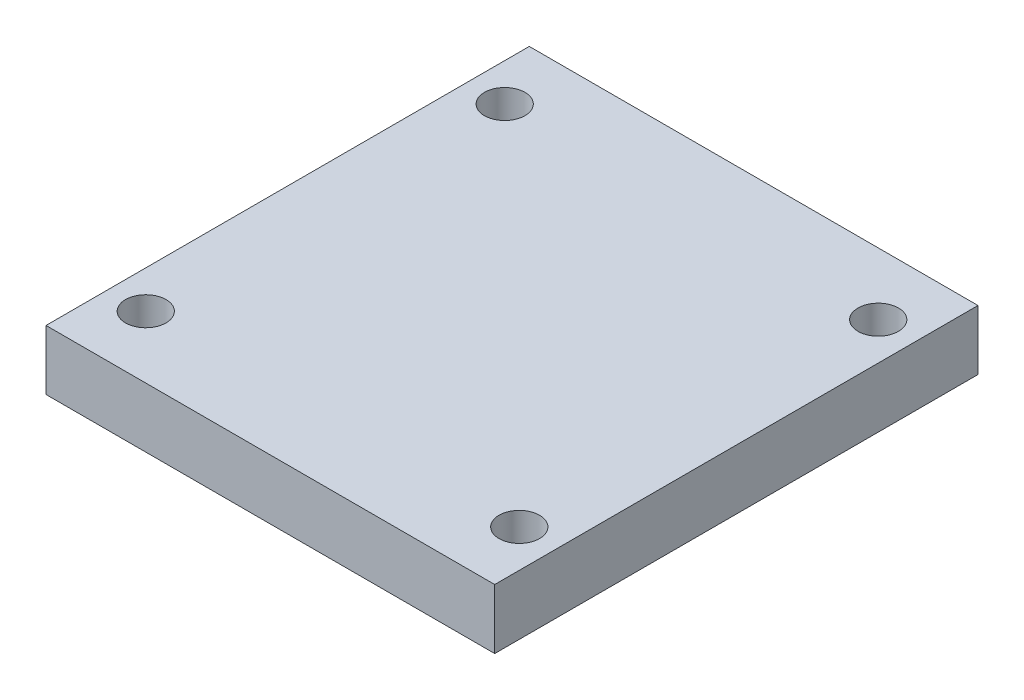
from build123d import *

# Parameters (mm, degrees)
SKETCH1_W           = 47.63
SKETCH1_H           = 51.3
SKETCH1_R           = 2.15
BOSS_EXTRUDE1_DEPTH = 6.35


with BuildPart() as part:
    # Sketch1 → Boss-Extrude1 (new body)
    with BuildSketch(Plane(origin=(0, 0, 0), x_dir=(1, 0, 0), z_dir=(0, 1, 0))):
        with Locations((-46.7225, 12.267391304)):
            Rectangle(SKETCH1_W, SKETCH1_H)
        with Locations(Location((-66.5475, 31.317391304, 0), (0, 0, 270))):
            Circle(SKETCH1_R, mode=Mode.SUBTRACT)
        with Locations(Location((-26.8975, 31.317391304, 0), (0, 0, 270))):
            Circle(SKETCH1_R, mode=Mode.SUBTRACT)
        with Locations(Location((-66.5475, -6.782608696, 0), (0, 0, 270))):
            Circle(SKETCH1_R, mode=Mode.SUBTRACT)
        with Locations(Location((-26.8975, -6.782608696, 0), (0, 0, 270))):
            Circle(SKETCH1_R, mode=Mode.SUBTRACT)
    extrude(amount=BOSS_EXTRUDE1_DEPTH)


solid = part.part
